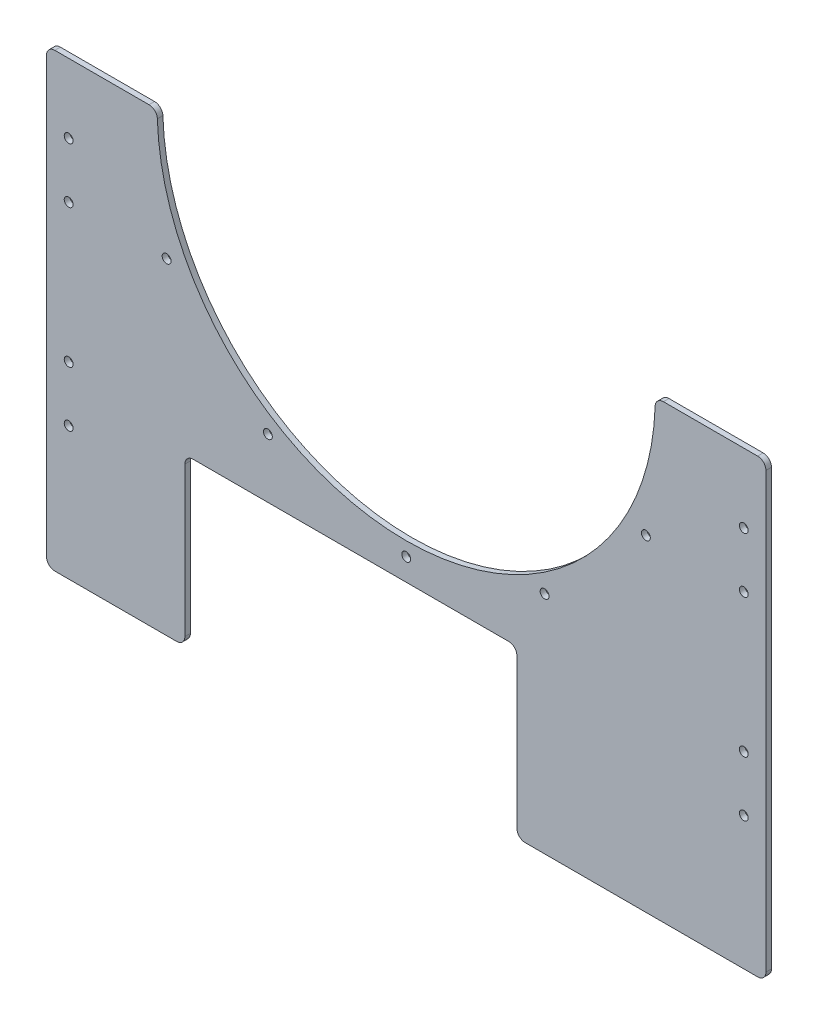
from build123d import *

# Parameters (mm, degrees)
SKETCH_1_W          = 260
SKETCH_1_H          = 163
EXTRUDE_1_DEPTH     = 2
SKETCH_2_R          = 1.6
CUT_EXTRUDE_1_DEPTH = 2
FILLET_1_R          = 3
SKETCH_3_R          = 90
SKETCH_3_R_2        = 1.6
CUT_EXTRUDE_2_DEPTH = 2
SKETCH_4_W          = 120
SKETCH_4_H          = 60
CUT_EXTRUDE_3_DEPTH = 2
FILLET_2_R          = 3


with BuildPart() as part:
    # 草图1 → 凸台-拉伸1 (new body)
    with BuildSketch(Plane.XY):
        Rectangle(SKETCH_1_W, SKETCH_1_H)
    extrude(amount=EXTRUDE_1_DEPTH)

    # 草图2 → 切除-拉伸1 (cut)
    with BuildSketch(Plane.XY.offset(2)):
        with Locations((-122, -33.5)):
            Circle(SKETCH_2_R)
        with Locations((-122, -13.5)):
            Circle(SKETCH_2_R)
        with Locations((-122, 36.5)):
            Circle(SKETCH_2_R)
        with Locations((-122, 56.5)):
            Circle(SKETCH_2_R)
        with Locations(Location((122, 56.5, 0), (0, 0, 180))):
            Circle(SKETCH_2_R)
        with Locations(Location((122, 36.5, 0), (0, 0, 180))):
            Circle(SKETCH_2_R)
        with Locations(Location((122, -13.5, 0), (0, 0, 180))):
            Circle(SKETCH_2_R)
        with Locations(Location((122, -33.5, 0), (0, 0, 180))):
            Circle(SKETCH_2_R)
    extrude(amount=-CUT_EXTRUDE_1_DEPTH, mode=Mode.SUBTRACT)

    # 圆角1
    fillet_1_edges = [part.edges().sort_by_distance(p)[0] for p in [
        (-130, 81.5, 1),
        (130, 81.5, 1),
        (130, -81.5, 1),
        (-130, -81.5, 1),
    ]]
    fillet(fillet_1_edges, radius=FILLET_1_R)

    # 草图3 → 切除-拉伸2 (cut)
    with BuildSketch(Plane.XY.offset(2)):
        with Locations((0, 81.5)):
            Circle(SKETCH_3_R)
        with Locations((0, -13.5)):
            Circle(SKETCH_3_R_2)
        with Locations((-50, -0.102540378)):
            Circle(SKETCH_3_R_2)
        with Locations((-86.602540378, 36.5)):
            Circle(SKETCH_3_R_2)
        with Locations((86.602540378, 36.5)):
            Circle(SKETCH_3_R_2)
        with Locations((50, -0.102540378)):
            Circle(SKETCH_3_R_2)
    extrude(amount=-CUT_EXTRUDE_2_DEPTH, mode=Mode.SUBTRACT)

    # 草图4 → 切除-拉伸3 (cut)
    with BuildSketch(Plane.XY.offset(2)):
        with Locations((-20, -51.5)):
            Rectangle(SKETCH_4_W, SKETCH_4_H)
    extrude(amount=-CUT_EXTRUDE_3_DEPTH, mode=Mode.SUBTRACT)

    # 圆角2
    fillet_2_edges = [part.edges().sort_by_distance(p)[0] for p in [
        (-80, -81.5, 1),
        (-80, -21.5, 1),
        (40, -21.5, 1),
        (40, -81.5, 1),
        (90, 81.5, 1),
        (-90, 81.5, 1),
    ]]
    fillet(fillet_2_edges, radius=FILLET_2_R)


solid = part.part
